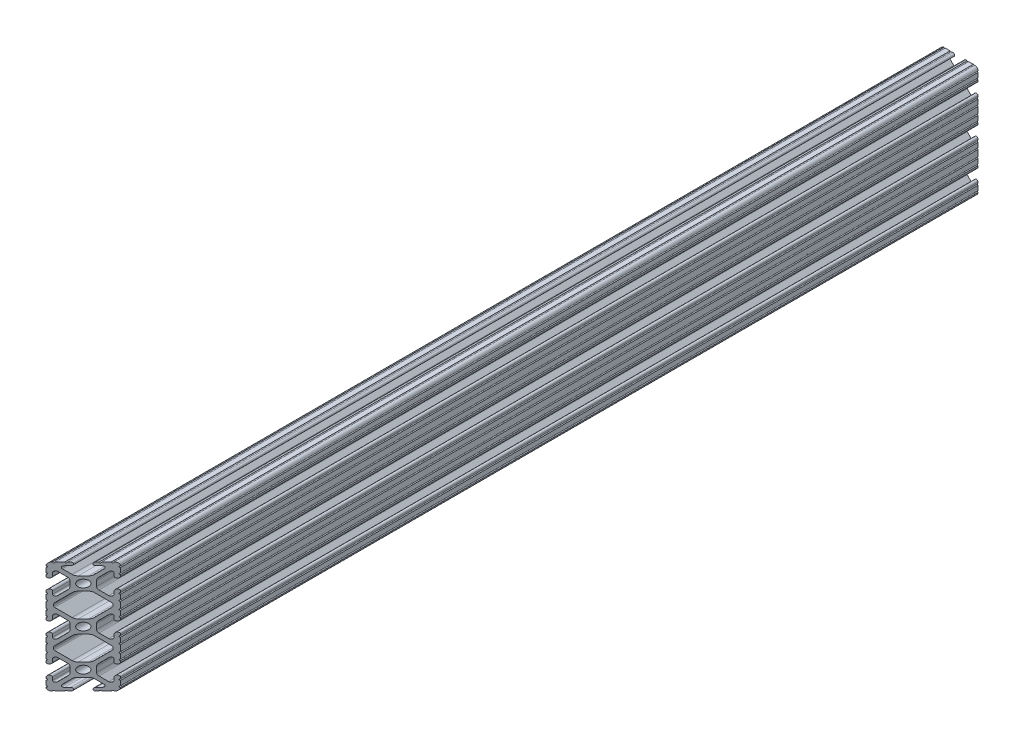
from build123d import *
from build123d.topology import SkipClean

# Parameters (mm, degrees)
BOSS_EXTRUDE1_DEPTH     = 304.8
CUT_EXTRUDE1_DEPTH      = 38.1
CUT_EXTRUDE1_DEPTH_BACK = 38.1


with BuildPart() as part:
    # Sketch3 → Boss-Extrude1 (new, symmetric)
    with BuildSketch(Plane.XY):
        with BuildLine():
            Line((-4.5085, 1.724757315), (-4.5085, 0))
            Line((-4.5085, 0), (-2.6035, 0))
            ThreePointArc((-2.6035, 0), (-1.840952505, 1.840952505), (0, 2.6035))
            Line((0, 2.6035), (0, 4.5085))
            Line((0, 4.5085), (-1.757798948, 4.5085))
            ThreePointArc((-1.757798948, 4.5085), (-2.870757174, 4.729881156), (-3.8142776, 5.360321348))
            Line((-3.8142776, 5.360321348), (-9.773146637, 11.319190385))
            ThreePointArc((-9.773146637, 11.319190385), (-10.059460087, 11.747688744), (-10.16, 12.253137022))
            Line((-10.16, 12.253137022), (-10.16, 13.146862978))
            ThreePointArc((-10.16, 13.146862978), (-10.059460087, 13.652311256), (-9.773146637, 14.080809615))
            Line((-9.773146637, 14.080809615), (-3.8142776, 20.039678652))
            ThreePointArc((-3.8142776, 20.039678652), (-2.870757174, 20.670118844), (-1.757798948, 20.8915))
            Line((-1.757798948, 20.8915), (0, 20.8915))
            Line((0, 20.8915), (0, 22.7965))
            ThreePointArc((0, 22.7965), (-2.6035, 25.4), (0, 28.0035))
            Line((0, 28.0035), (0, 29.9085))
            Line((0, 29.9085), (-1.757798948, 29.9085))
            ThreePointArc((-1.757798948, 29.9085), (-2.870757174, 30.129881156), (-3.8142776, 30.760321348))
            Line((-3.8142776, 30.760321348), (-7.140358942, 34.086402691))
            ThreePointArc((-7.140358942, 34.086402691), (-7.369409702, 35.237918622), (-6.393201633, 35.8902))
            Line((-6.393201633, 35.8902), (-4.3561, 35.8902))
            ThreePointArc((-4.3561, 35.8902), (-3.2512, 36.9951), (-4.3561, 38.1))
            Line((-4.3561, 38.1), (-5.3086, 38.1))
            ThreePointArc((-5.3086, 38.1), (-5.8166, 37.592), (-6.3246, 38.1))
            Line((-6.3246, 38.1), (-9.5504, 38.1))
            ThreePointArc((-9.5504, 38.1), (-10.0584, 37.592), (-10.5664, 38.1))
            ThreePointArc((-10.5664, 38.1), (-12.079551533, 37.426060101), (-12.7, 35.8902))
            ThreePointArc((-12.7, 35.8902), (-12.192, 35.3822), (-12.7, 34.8742))
            Line((-12.7, 34.8742), (-12.7, 31.7246))
            ThreePointArc((-12.7, 31.7246), (-12.192, 31.2166), (-12.7, 30.7086))
            Line((-12.7, 30.7086), (-12.7, 29.7561))
            ThreePointArc((-12.7, 29.7561), (-11.5951, 28.6512), (-10.4902, 29.7561))
            Line((-10.4902, 29.7561), (-10.4902, 31.76016))
            ThreePointArc((-10.4902, 31.76016), (-9.837918622, 32.736368069), (-8.686402691, 32.507317309))
            Line((-8.686402691, 32.507317309), (-5.360321348, 29.181235967))
            ThreePointArc((-5.360321348, 29.181235967), (-4.729881156, 28.237715541), (-4.5085, 27.124757315))
            Line((-4.5085, 27.124757315), (-4.5085, 23.675242685))
            ThreePointArc((-4.5085, 23.675242685), (-4.729881156, 22.562284459), (-5.360321348, 21.618764033))
            Line((-5.360321348, 21.618764033), (-8.686402691, 18.292682691))
            ThreePointArc((-8.686402691, 18.292682691), (-9.837918622, 18.063631931), (-10.4902, 19.03984))
            Line((-10.4902, 19.03984), (-10.4902, 21.0439))
            ThreePointArc((-10.4902, 21.0439), (-11.5951, 22.1488), (-12.7, 21.0439))
            Line((-12.7, 21.0439), (-12.7, 20.0914))
            ThreePointArc((-12.7, 20.0914), (-12.192, 19.5834), (-12.7, 19.0754))
            Line((-12.7, 19.0754), (-12.7, 15.8496))
            ThreePointArc((-12.7, 15.8496), (-12.192, 15.3416), (-12.7, 14.8336))
            Line((-12.7, 14.8336), (-12.7, 10.5664))
            ThreePointArc((-12.7, 10.5664), (-12.192, 10.0584), (-12.7, 9.5504))
            Line((-12.7, 9.5504), (-12.7, 6.3246))
            ThreePointArc((-12.7, 6.3246), (-12.192, 5.8166), (-12.7, 5.3086))
            Line((-12.7, 5.3086), (-12.7, 4.3561))
            ThreePointArc((-12.7, 4.3561), (-11.5951, 3.2512), (-10.4902, 4.3561))
            Line((-10.4902, 4.3561), (-10.4902, 6.36016))
            ThreePointArc((-10.4902, 6.36016), (-9.837918622, 7.336368069), (-8.686402691, 7.107317309))
            Line((-8.686402691, 7.107317309), (-5.360321348, 3.781235967))
            ThreePointArc((-5.360321348, 3.781235967), (-4.729881156, 2.837715541), (-4.5085, 1.724757315))
        make_face()
    extrude(amount=BOSS_EXTRUDE1_DEPTH, both=True)

    # Mirror1: part across plane


with BuildPart() as part_1:
    with SkipClean():  # the faces are left unmerged after this step: merging them gives an invalid solid
        add(part.part)
        add(part.part.mirror(Plane(origin=(0, 0, 0), x_dir=(0, 0, 1), z_dir=(1, 0, 0))))

    # Mirror2: part across plane


with BuildPart() as part_2:
    with SkipClean():  # the faces are left unmerged after this step: merging them gives an invalid solid
        add(part_1.part)
        add(part_1.part.mirror(Plane.ZX))

    # Sketch9 → Cut-Extrude1 (cut, two sides: drawn at the far end of the back side and taken through both)
    with SkipClean():  # the faces are left unmerged after this step: merging them gives an invalid solid
        with BuildSketch(Plane(origin=(0, 0, 0), x_dir=(1, 0, 0), z_dir=(0, 1, 0)).offset(-CUT_EXTRUDE1_DEPTH_BACK)):
            Polygon((-12.7, -304.8), (12.7, -279.4), (12.954, -279.4), (12.954, -305.054), (-12.7, -305.054), align=None)
        extrude(amount=CUT_EXTRUDE1_DEPTH + CUT_EXTRUDE1_DEPTH_BACK, mode=Mode.SUBTRACT)


solid = part_2.part
